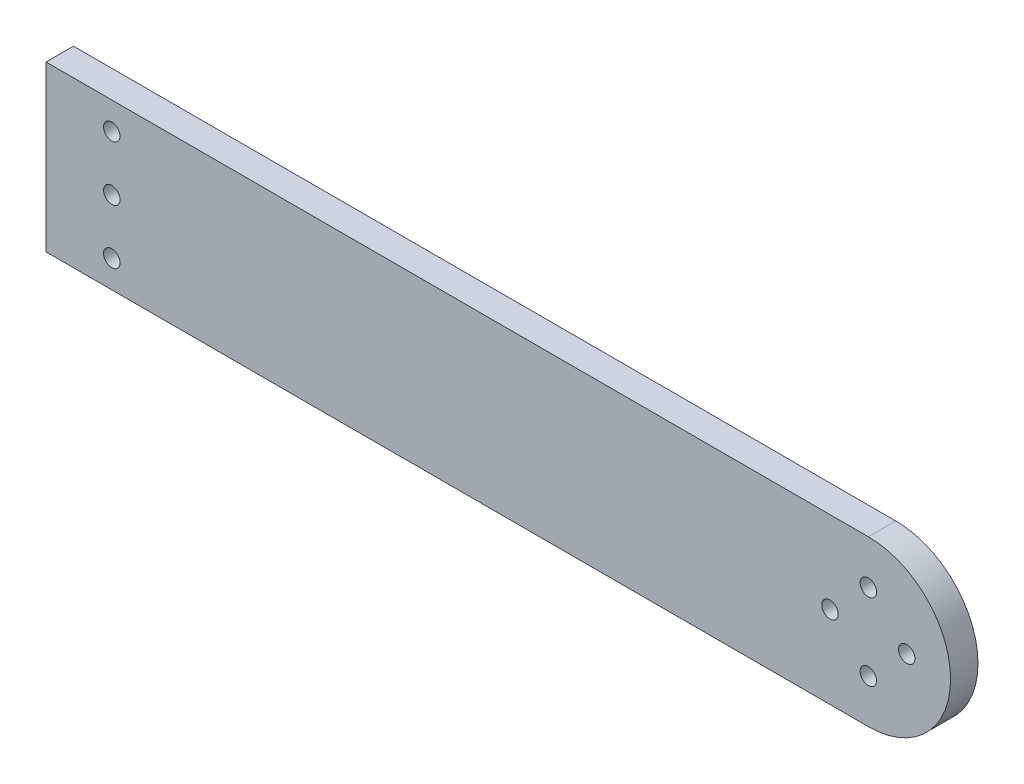
from build123d import *

# Parameters (mm, degrees)
SKETCH1_R           = 1.5
BOSS_EXTRUDE1_DEPTH = 5


with BuildPart() as part:
    # Sketch1 → Boss-Extrude1 (new body)
    with BuildSketch(Plane.XY):
        with BuildLine():
            Line((75.000000208, -15), (-75.000000208, -15))
            Line((-75.000000208, -15), (-75.000000208, 15))
            Line((-75.000000208, 15), (75.000000208, 15))
            ThreePointArc((75.000000208, 15), (89.999999792, 0), (75.000000208, -15))
        make_face()
        with Locations((75, 7)):
            Circle(SKETCH1_R, mode=Mode.SUBTRACT)
        with Locations((82, 0)):
            Circle(SKETCH1_R, mode=Mode.SUBTRACT)
        with Locations(Location((68, 0, 0), (0, 0, 180))):
            Circle(SKETCH1_R, mode=Mode.SUBTRACT)
        with Locations(Location((75, -7, 0), (0, 0, 180))):
            Circle(SKETCH1_R, mode=Mode.SUBTRACT)
        with Locations((-63.000000208, 0)):
            Circle(SKETCH1_R, mode=Mode.SUBTRACT)
        with Locations((-63.000000208, 10)):
            Circle(SKETCH1_R, mode=Mode.SUBTRACT)
        with Locations((-63.000000208, -10)):
            Circle(SKETCH1_R, mode=Mode.SUBTRACT)
    extrude(amount=BOSS_EXTRUDE1_DEPTH)


solid = part.part
